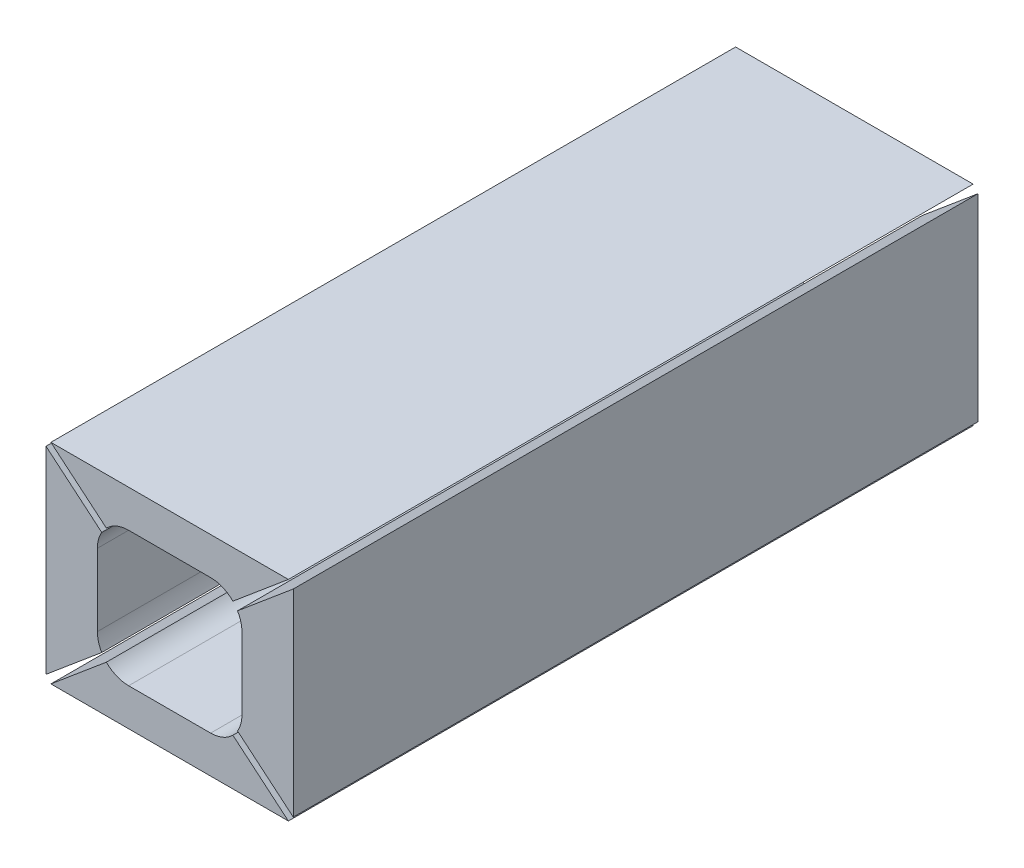
from build123d import *

# Parameters (mm, degrees)
EXTRUDE_1_DEPTH   = 90
EXTRUDE_1_2_DEPTH = 90
EXTRUDE_1_3_DEPTH = 90
EXTRUDE_1_4_DEPTH = 90


with BuildPart() as part:
    # 草图1 → 凸台-拉伸1 (new, symmetric)
    with BuildSketch(Plane.XY):
        with BuildLine():
            Line((31.217499969, 27.5), (-31.217499969, 27.5))
            Line((-31.217499969, 27.5), (-16.627276387, 15.257348773))
            ThreePointArc((-16.627276387, 15.257348773), (-13.948484897, 17.064794227), (-10.78, 17.7))
            Line((-10.78, 17.7), (10.78, 17.7))
            ThreePointArc((10.78, 17.7), (13.948484897, 17.064794227), (16.627276387, 15.257348773))
            Line((16.627276387, 15.257348773), (31.217499969, 27.5))
        make_face()
    extrude(amount=EXTRUDE_1_DEPTH, both=True)


with BuildPart() as body_2:
    # 草图1 → Extrude 1 2 (new, symmetric)
    with BuildSketch(Plane.XY):
        with BuildLine():
            Line((-32.5, -25.965330724), (-32.5, 25.965330724))
            Line((-32.5, 25.965330724), (-17.850295924, 13.672769437))
            ThreePointArc((-17.850295924, 13.672769437), (-18.707365025, 11.65377178), (-19, 9.48))
            Line((-19, 9.48), (-19, -9.48))
            ThreePointArc((-19, -9.48), (-18.707365025, -11.65377178), (-17.850295924, -13.672769437))
            Line((-17.850295924, -13.672769437), (-32.5, -25.965330724))
        make_face()
    extrude(amount=EXTRUDE_1_2_DEPTH, both=True)


with BuildPart() as body_3:
    # 草图1 → Extrude 1 3 (new, symmetric)
    with BuildSketch(Plane.XY):
        with BuildLine():
            Line((19, -9.48), (19, 9.48))
            ThreePointArc((19, 9.48), (18.707365025, 11.65377178), (17.850295924, 13.672769437))
            Line((17.850295924, 13.672769437), (32.5, 25.965330724))
            Line((32.5, 25.965330724), (32.5, -25.965330724))
            Line((32.5, -25.965330724), (17.850295924, -13.672769437))
            ThreePointArc((17.850295924, -13.672769437), (18.707365025, -11.65377178), (19, -9.48))
        make_face()
    extrude(amount=EXTRUDE_1_3_DEPTH, both=True)


with BuildPart() as body_4:
    # 草图1 → Extrude 1 4 (new, symmetric)
    with BuildSketch(Plane.XY):
        with BuildLine():
            Line((16.627276387, -15.257348773), (31.217499969, -27.5))
            Line((31.217499969, -27.5), (-31.217499969, -27.5))
            Line((-31.217499969, -27.5), (-16.627276387, -15.257348773))
            ThreePointArc((-16.627276387, -15.257348773), (-13.948484897, -17.064794227), (-10.78, -17.7))
            Line((-10.78, -17.7), (10.78, -17.7))
            ThreePointArc((10.78, -17.7), (13.948484897, -17.064794227), (16.627276387, -15.257348773))
        make_face()
    extrude(amount=EXTRUDE_1_4_DEPTH, both=True)


solid = Compound([part.part, body_2.part, body_3.part, body_4.part])
